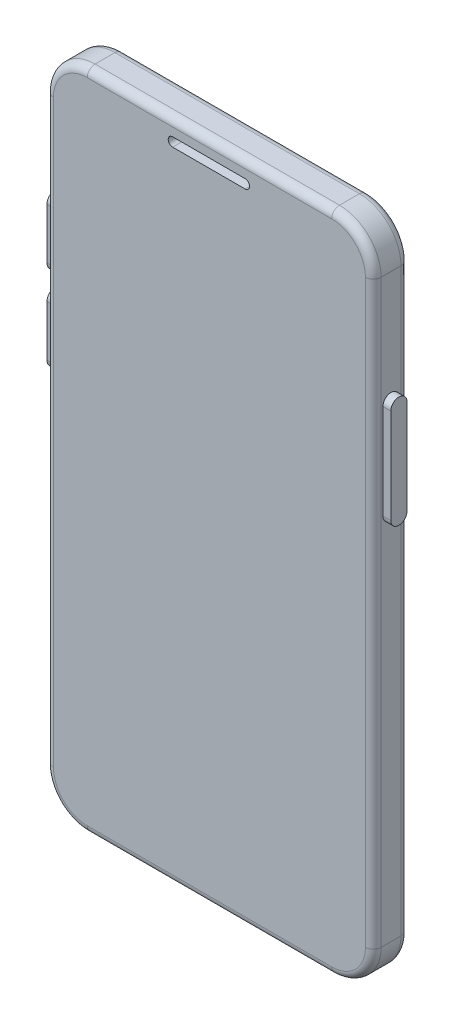
from build123d import *

# Parameters (mm, degrees)
SKETCH1_W           = 70.9
SKETCH1_H           = 143.6
BOSS_EXTRUDE1_DEPTH = 7.7
FILLET1_R           = 9
BOSS_EXTRUDE2_DEPTH = 1.7
BOSS_EXTRUDE3_DEPTH = 1.7
SKETCH4_W           = 3.333340828
SKETCH4_H           = 6.136400457
CUT_EXTRUDE1_DEPTH  = 1.7
SKETCH5_W           = 1.382906497
SKETCH5_H           = 5.927261181
BOSS_EXTRUDE4_DEPTH = 1.7
BOSS_EXTRUDE5_DEPTH = 1.7
SKETCH7_R           = 1.766648845
CUT_EXTRUDE2_DEPTH  = 0.7
CUT_EXTRUDE3_DEPTH  = 6.7
SKETCH9_R           = 1.234780667
CUT_EXTRUDE4_DEPTH  = 4.7
LPATTERN1_COUNT     = 5
LPATTERN1_PITCH     = 4
SKETCH10_R          = 1.403334483
CUT_EXTRUDE5_DEPTH  = 4.7
LPATTERN2_COUNT     = 5
LPATTERN2_PITCH     = 4
CUT_EXTRUDE6_DEPTH  = 2.7
FILLET2_R           = 1.7
FILLET3_R           = 1.7


with BuildPart() as part:
    # Sketch1 → Boss-Extrude1 (new body)
    with BuildSketch(Plane.XY):
        with Locations((35.45, -71.8)):
            Rectangle(SKETCH1_W, SKETCH1_H)
    extrude(amount=BOSS_EXTRUDE1_DEPTH)

    # Fillet1
    fillet1_edges = [part.edges().sort_by_distance(p)[0] for p in [
        (0, 0, 3.85),
        (70.9, 0, 3.85),
        (70.9, -143.6, 3.85),
        (0, -143.6, 3.85),
    ]]
    fillet(fillet1_edges, radius=FILLET1_R)

    # Sketch2 → Boss-Extrude2 (add)
    with BuildSketch(Plane(origin=(70.9, -8.327936867, 0), x_dir=(0, 0, -1), z_dir=(1, 0, 0))):
        with BuildLine():
            Line((-5.605090694, -45.631969305), (-5.605090694, -25.092533891))
            ThreePointArc((-5.605090694, -25.092533891), (-3.85, -23.337443197), (-2.094909306, -25.092533891))
            Line((-2.094909306, -25.092533891), (-2.094909306, -45.631969305))
            ThreePointArc((-2.094909306, -45.631969305), (-3.85, -47.387059999), (-5.605090694, -45.631969305))
        make_face()
    extrude(amount=BOSS_EXTRUDE2_DEPTH)

    # Sketch3 → Boss-Extrude3 (add)
    with BuildSketch(Plane.ZY):
        with BuildLine():
            ThreePointArc((5.711355616, -60.986538732), (3.85, -62.847894348), (1.988644384, -60.986538732))
            Line((1.988644384, -60.986538732), (1.988644384, -49.990125604))
            ThreePointArc((1.988644384, -49.990125604), (3.85, -48.128769988), (5.711355616, -49.990125604))
            Line((5.711355616, -49.990125604), (5.711355616, -60.986538732))
        make_face()
        with BuildLine():
            ThreePointArc((5.711355616, -31.75341953), (3.85, -29.892063915), (1.988644384, -31.75341953))
            Line((1.988644384, -31.75341953), (1.988644384, -42.749832659))
            ThreePointArc((1.988644384, -42.749832659), (3.85, -44.611188275), (5.711355616, -42.749832659))
            Line((5.711355616, -42.749832659), (5.711355616, -31.75341953))
        make_face()
    extrude(amount=BOSS_EXTRUDE3_DEPTH)

    # Sketch4 → Cut-Extrude1 (cut)
    with BuildSketch(Plane.ZY):
        with Locations((3.85, -22.514232186)):
            Rectangle(SKETCH4_W, SKETCH4_H)
    extrude(amount=-CUT_EXTRUDE1_DEPTH, mode=Mode.SUBTRACT)

    # Sketch5 → Boss-Extrude4 (add)
    with BuildSketch(Plane.ZY.offset(-1.7)):
        with Locations((3.095312634, -22.618801824)):
            Rectangle(SKETCH5_W, SKETCH5_H)
    extrude(amount=BOSS_EXTRUDE4_DEPTH)

    # Sketch6 → Boss-Extrude5 (add)
    with BuildSketch(Plane(origin=(0, 0, 0), x_dir=(-1, 0, 0), z_dir=(0, 0, -1))):
        with BuildLine():
            ThreePointArc((-58.291417144, -28.459192447), (-62.200913295, -32.368688598), (-66.110409446, -28.459192447))
            Line((-66.110409446, -28.459192447), (-66.110409446, -9.312433578))
            ThreePointArc((-66.110409446, -9.312433578), (-62.200913295, -5.402937427), (-58.291417144, -9.312433578))
            Line((-58.291417144, -9.312433578), (-58.291417144, -28.459192447))
        make_face()
    extrude(amount=BOSS_EXTRUDE5_DEPTH)

    # Sketch7 → Cut-Extrude2 (cut)
    with BuildSketch(Plane(origin=(0, 0, -1.7), x_dir=(-1, 0, 0), z_dir=(0, 0, -1))):
        with Locations((-62.200913295, -18.885813012)):
            Circle(SKETCH7_R)
    extrude(amount=-CUT_EXTRUDE2_DEPTH, mode=Mode.SUBTRACT)

    # Sketch8 → Cut-Extrude3 (cut)
    with BuildSketch(Plane(origin=(0, -143.6, 0), x_dir=(-1, 0, 0), z_dir=(0, -1, 0))):
        with BuildLine():
            Line((-32.382593944, -2.596190666), (-38.517406056, -2.596190666))
            ThreePointArc((-38.517406056, -2.596190666), (-39.77121539, -3.85), (-38.517406056, -5.103809334))
            Line((-38.517406056, -5.103809334), (-32.382593944, -5.103809334))
            ThreePointArc((-32.382593944, -5.103809334), (-31.12878461, -3.85), (-32.382593944, -2.596190666))
        make_face()
    extrude(amount=-CUT_EXTRUDE3_DEPTH, mode=Mode.SUBTRACT)

    # Sketch9 → Cut-Extrude4 (cut)
    with BuildSketch(Plane.XZ.offset(143.6)):
        with Locations(Location((44.624064911, 3.85, 0), (0, 0, 270))):
            Circle(SKETCH9_R)
    cut_extrude4 = extrude(amount=-CUT_EXTRUDE4_DEPTH, mode=Mode.SUBTRACT)

    # LPattern1: Cut-Extrude4 ×5
    with Locations(*[(i * LPATTERN1_PITCH, 0, 0) for i in range(1, LPATTERN1_COUNT)]):
        add(cut_extrude4, mode=Mode.SUBTRACT)

    # Sketch10 → Cut-Extrude5 (cut)
    with BuildSketch(Plane.XZ.offset(143.6)):
        with Locations(Location((26.034503903, 3.85, 0), (0, 0, 270))):
            Circle(SKETCH10_R)
    cut_extrude5 = extrude(amount=-CUT_EXTRUDE5_DEPTH, mode=Mode.SUBTRACT)

    # LPattern2: Cut-Extrude5 ×5
    with Locations(*[(-i * LPATTERN2_PITCH, 0, 0) for i in range(1, LPATTERN2_COUNT)]):
        add(cut_extrude5, mode=Mode.SUBTRACT)

    # Sketch11 → Cut-Extrude6 (cut)
    with BuildSketch(Plane(origin=(0, -1.738509759, 7.7), x_dir=(1, 0, 0), z_dir=(0, 0, 1))):
        with BuildLine():
            Line((27.492370642, -3.734093894), (43.158394407, -3.734093894))
            ThreePointArc((43.158394407, -3.734093894), (44.126748247, -2.765740054), (43.158394407, -1.797386213))
            Line((43.158394407, -1.797386213), (27.492370642, -1.797386213))
            ThreePointArc((27.492370642, -1.797386213), (26.524016802, -2.765740054), (27.492370642, -3.734093894))
        make_face()
    extrude(amount=-CUT_EXTRUDE6_DEPTH, mode=Mode.SUBTRACT)

    # Fillet2
    fillet2_edges = [part.edges().sort_by_distance(p)[0] for p in [
        (68.263961031, -2.636038969, 7.7),
        (70.9, -71.8, 7.7),
        (68.263961031, -140.963961031, 7.7),
        (35.45, -143.6, 7.7),
        (2.636038969, -140.963961031, 7.7),
        (0, -71.8, 7.7),
        (2.636038969, -2.636038969, 7.7),
        (35.45, 0, 7.7),
    ]]
    fillet(fillet2_edges, radius=FILLET2_R)

    # Fillet3
    fillet3_edges = [part.edges().sort_by_distance(p)[0] for p in [
        (35.45, -143.6, 0),
        (0, -71.8, 0),
        (35.45, 0, 0),
        (70.9, -71.8, 0),
        (68.263961031, -2.636038969, 0),
        (2.636038969, -2.636038969, 0),
        (68.263961031, -140.963961031, 0),
        (2.636038969, -140.963961031, 0),
    ]]
    fillet(fillet3_edges, radius=FILLET3_R)


solid = part.part
